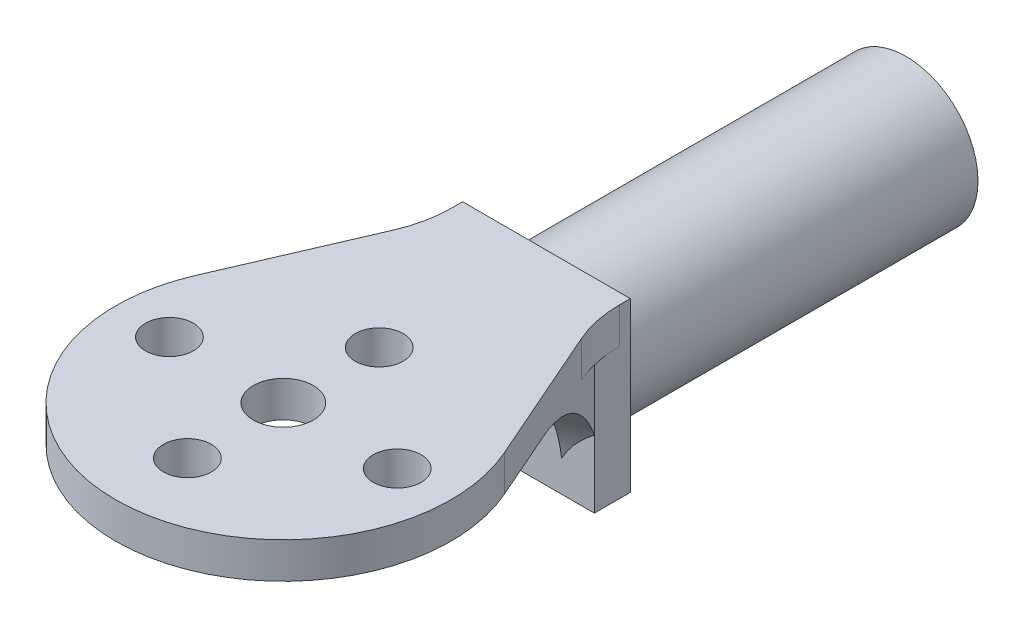
from build123d import *

# Parameters (mm, degrees)
SKETCH1_R                   = 6
ARM_INSERT_DEPTH            = 30
SKETCH2_W                   = 14
SKETCH2_H                   = 14
FACE_PLATE_DEPTH            = 3
SKETCH3_R                   = 2
SKETCH3_R_2                 = 2.5
MOTOR_MOUNT_DEPTH           = 3
MOTOR_MOUNT_SUPPORT_1_DEPTH = 2.5
MOTOR_MOUNT_SUPPORT_2_DEPTH = 2.5
SKETCH8_R                   = 2.5
LIGHTENING_HOLE_DEPTH       = 68.841325022


with BuildPart() as part:
    # Sketch1 → Arm Insert (new body)
    with BuildSketch(Plane.XY):
        Circle(SKETCH1_R)
    extrude(amount=ARM_INSERT_DEPTH)

    # Sketch2 → Face Plate (add)
    with BuildSketch(Plane.XY.offset(30)):
        Rectangle(SKETCH2_W, SKETCH2_H)
    extrude(amount=FACE_PLATE_DEPTH)

    # Sketch3 → Motor Mount (add)
    # profile 1 of 2: a face of its own
    with BuildSketch(Plane(origin=(0, 7, 0), x_dir=(1, 0, 0), z_dir=(0, 1, 0))):
        with BuildLine():
            ThreePointArc((-7, -30.935385736), (-7.206551185, -32.957355148), (-7.817672061, -34.895796524))
            Line((-7.817672061, -34.895796524), (-12.803400836, -46.455354126))
            ThreePointArc((-12.803400836, -46.455354126), (0.006350978, -38.000003191), (12.870800409, -46.371899141))
            Line((12.870800409, -46.371899141), (7.843612764, -34.921493496))
            ThreePointArc((7.843612764, -34.921493496), (7.213175378, -32.95526455), (7, -30.901472004))
            Line((7, -30.901472004), (7, -33))
            Line((7, -33), (-7, -33))
            Line((-7, -33), (-7, -30.935385736))
        make_face()
    # profile 2 of 2: a face of its own
    with BuildSketch(Plane(origin=(0, 7, 0), x_dir=(1, 0, 0), z_dir=(0, 1, 0))):
        with BuildLine():
            ThreePointArc((12.870800409, -46.371899141), (0.006350978, -38.000003191), (-12.803400836, -46.455354126))
            ThreePointArc((-12.803400836, -46.455354126), (-2.778898897, -65.710757571), (14.051858279, -51.999929229))
            ThreePointArc((14.051858279, -51.999929229), (13.75341275, -49.124619665), (12.870800409, -46.371899141))
        make_face()
        with Locations(Location((-9.448141721, -51.999929229, 0), (0, 0, 270))):
            Circle(SKETCH3_R, mode=Mode.SUBTRACT)
        with Locations(Location((0.051858279, -59.999929229, 0), (0, 0, 270))):
            Circle(SKETCH3_R, mode=Mode.SUBTRACT)
        with Locations(Location((0.051858279, -51.999929229, 0), (0, 0, 270))):
            Circle(SKETCH3_R_2, mode=Mode.SUBTRACT)
        with Locations(Location((9.551858279, -51.999929229, 0), (0, 0, 270))):
            Circle(SKETCH3_R, mode=Mode.SUBTRACT)
        with Locations(Location((0.051858279, -43.999929229, 0), (0, 0, 270))):
            Circle(SKETCH3_R, mode=Mode.SUBTRACT)
    extrude(amount=-MOTOR_MOUNT_DEPTH)

    # Sketch4 → Motor Mount Support 1 (add)
    with BuildSketch(Plane(origin=(6.098650662, 0, 2.630396348), x_dir=(-0.39604107883214285, 0, 0.9182327939457796), z_dir=(-0.9182327939457796, 0, -0.39604107883214285))):
        with BuildLine():
            Line((31.696620561, -7), (31.696620561, 4))
            Line((31.696620561, 4), (41.433043154, 4))
            add(Edge.make_bspline(
                [(41.433043154, 4), (31.696620561, 4), (31.696620561, -7)],
                knots=[3.141592654, 3.141592654, 3.141592654, 4.71238898, 4.71238898, 4.71238898], degree=2, weights=[1, 0.707106781, 1]))
        make_face()
    extrude(amount=-MOTOR_MOUNT_SUPPORT_1_DEPTH)

    # Sketch5 → Motor Mount Support 2 (add)
    with BuildSketch(Plane(origin=(-6.278168341, 0, 2.756367878), x_dir=(-0.402002149140903, 0, -0.9156387235619163), z_dir=(0.9156387235619163, 0, -0.402002149140903))):
        with BuildLine():
            Line((-31.656634836, -7), (-31.656634836, 4))
            Line((-31.656634836, 4), (-41.381308441, 4))
            add(Edge.make_bspline(
                [(-31.656634836, -7), (-31.656634836, 4), (-41.381308441, 4)],
                knots=[1.570796327, 1.570796327, 1.570796327, 3.141592654, 3.141592654, 3.141592654], degree=2, weights=[1, 0.707106781, 1]))
        make_face()
    extrude(amount=-MOTOR_MOUNT_SUPPORT_2_DEPTH)

    # Sketch8 → Lightening Hole (cut, through all)
    with BuildSketch(Plane(origin=(0, 0, 0), x_dir=(-1, 0, 0), z_dir=(0, 0, -1))):
        Circle(SKETCH8_R)
    extrude(amount=-LIGHTENING_HOLE_DEPTH, mode=Mode.SUBTRACT)


solid = part.part
